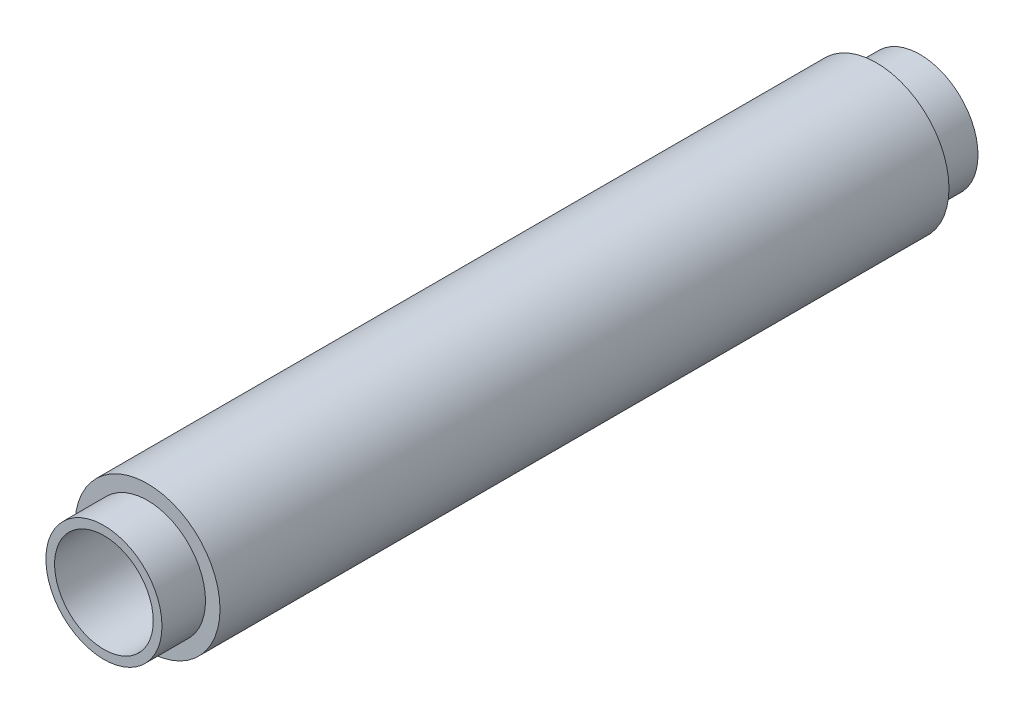
from build123d import *


with BuildPart() as part:
    # Эскиз1 → Повернуть1 (revolve)
    with BuildSketch(Plane(origin=(0, 0, 0), x_dir=(1, 0, 0), z_dir=(0, 1, 0)), mode=Mode.PRIVATE) as revolve_1_sk:
        Polygon((-25, 0), (-17, 0), (-17, -140.6), (-20, -140.6), (-20, -125.6), (-25, -125.6), align=None)
    revolve_1 = revolve(revolve_1_sk.sketch.rotate(Axis((0, 0, 1000), (0, 0, -1)), 180), axis=Axis((0, 0, 1000), (0, 0, -1)))

    # Зеркальное отражение1: Повернуть1 across plane
    add(revolve_1.mirror(Plane(origin=(-25, 0, 0), x_dir=(1, 0, 0), z_dir=(0, 0, 1))))


solid = part.part
